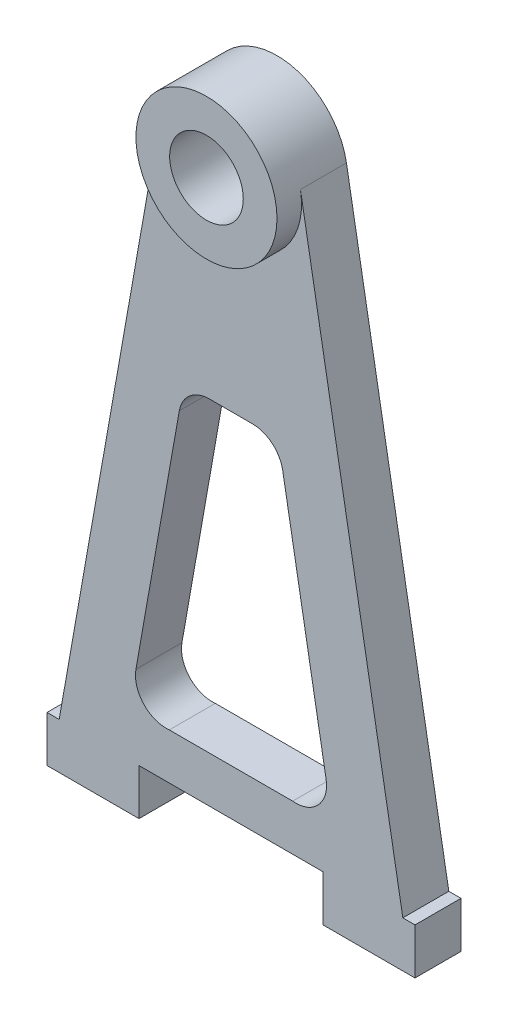
from build123d import *

# Parameters (mm, degrees)
SKETCH1_R           = 6
BOSS_EXTRUDE1_DEPTH = 7.5
SKETCH2_R           = 11.5
SKETCH2_R_2         = 6
BOSS_EXTRUDE2_DEPTH = 4
SKETCH3_W           = 30
SKETCH3_H           = 7.5
CUT_EXTRUDE1_DEPTH  = 17


with BuildPart() as part:
    # Sketch1 → Boss-Extrude1 (new body)
    with BuildSketch(Plane.XY):
        with BuildLine():
            Line((-7.688799634, 14.058259775), (-24.377907333, -80.441740225))
            Line((-24.377907333, -80.441740225), (-26.364047981, -80.441740225))
            Line((-26.364047981, -80.441740225), (-26.364047981, -87.941740225))
            Line((-26.364047981, -87.941740225), (33.635952019, -87.941740225))
            Line((33.635952019, -87.941740225), (33.635952019, -80.441740225))
            Line((33.635952019, -80.441740225), (31.649811371, -80.441740225))
            Line((31.649811371, -80.441740225), (14.960703672, 14.058259775))
            ThreePointArc((14.960703672, 14.058259775), (3.635952019, 23.558259775), (-7.688799634, 14.058259775))
        make_face()
        with Locations((3.635952019, 12.058259775)):
            Circle(SKETCH1_R, mode=Mode.SUBTRACT)
        with BuildLine():
            Line((-4.797863794, -27.072175008), (-11.866873907, -67.099566987))
            ThreePointArc((-11.866873907, -67.099566987), (-10.600291138, -71.378637309), (-6.42041267, -72.941740225))
            Line((-6.42041267, -72.941740225), (13.692316708, -72.941740225))
            ThreePointArc((13.692316708, -72.941740225), (17.872195176, -71.378637309), (19.138777944, -67.099566987))
            Line((19.138777944, -67.099566987), (12.069767832, -27.072175008))
            ThreePointArc((12.069767832, -27.072175008), (10.3593857, -24.111085837), (7.145962765, -22.941740225))
            Line((7.145962765, -22.941740225), (0.125941273, -22.941740225))
            ThreePointArc((0.125941273, -22.941740225), (-3.087481662, -24.111085837), (-4.797863794, -27.072175008))
        make_face(mode=Mode.SUBTRACT)
    extrude(amount=BOSS_EXTRUDE1_DEPTH)

    # Sketch2 → Boss-Extrude2 (add)
    with BuildSketch(Plane.XY.offset(7.5)):
        with Locations(Location((3.635952019, 12.058259775, 0), (0, 0, 169.984589832))):
            Circle(SKETCH2_R)
        with Locations((3.635952019, 12.058259775)):
            Circle(SKETCH2_R_2, mode=Mode.SUBTRACT)
    extrude(amount=BOSS_EXTRUDE2_DEPTH)

    # Sketch3 → Cut-Extrude1 (cut)
    with BuildSketch(Plane.XY.offset(7.5)):
        with Locations((3.635952019, -84.191740225)):
            Rectangle(SKETCH3_W, SKETCH3_H)
    extrude(amount=-CUT_EXTRUDE1_DEPTH, mode=Mode.SUBTRACT)


solid = part.part
